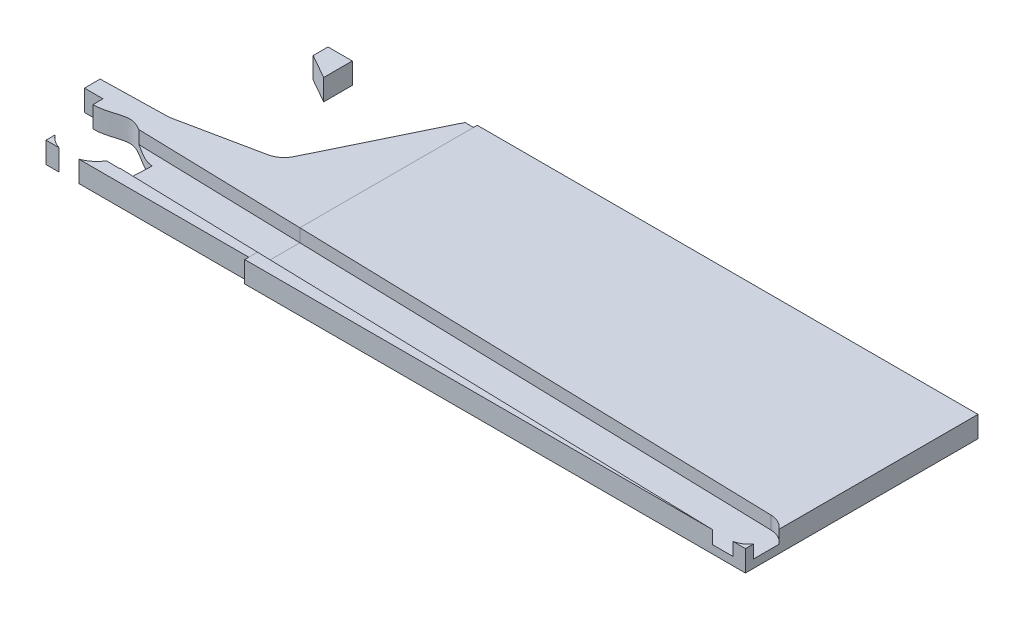
from build123d import *

# Parameters (mm, degrees)
BOSS_EXTRUDE1_DEPTH   = 50.8
BOSS_EXTRUDE1_2_DEPTH = 50.8
SKETCH2_W             = 1201.775932767
SKETCH2_H             = 558.199404441
BOSS_EXTRUDE2_DEPTH   = 50.8
CUT_EXTRUDE1_START    = 50.8
CUT_EXTRUDE1_DEPTH    = 31.242
CUT_EXTRUDE2_DEPTH    = 34.544


with BuildPart() as part:
    # Sketch1 → Boss-Extrude1 (new body)
    with BuildSketch(Plane(origin=(0, 0, 0), x_dir=(1, 0, 0), z_dir=(0, 1, 0))):
        with BuildLine():
            Line((-871.820440323, -76.649300831), (-871.641101875, -114.290321726))
            Line((-871.641101875, -114.290321726), (-827.305117277, -114.290321726))
            Line((-827.305117277, -114.290321726), (-827.305117277, -138.423193725))
            add(Edge.make_bspline(
                [(-827.305117277, -138.423193725), (-792.273117361, -138.423193725), (-743.797362049, -100.228210329), (-689.293747089, -162.520410056), (-659.829397565, -163.748236388)],
                knots=[0, 0, 0, 0, 0.467854577, 1, 1, 1, 1], degree=3))
            Line((-659.829397565, -163.748236388), (-662.985161767, -239.477626694))
            Line((-662.985161767, -239.477626694), (-809.749405531, -236.047842805))
            Line((-809.749405531, -236.047842805), (-809.749405531, -268.614984646))
            Line((-809.749405531, -268.614984646), (-323.022309341, -268.614984646))
            Line((-323.022309341, -268.614984646), (-323.022309341, 270.917349392))
            Line((-323.022309341, 270.917349392), (-343.528617531, 270.917349392))
            Line((-343.528617531, 270.917349392), (-477.930602029, -5.236006151))
            ThreePointArc((-477.930602029, -5.236006151), (-492.433794564, -23.115048161), (-513.339441144, -32.756452519))
            Line((-513.339441144, -32.756452519), (-708.834673801, -73.106313327))
            Line((-708.834673801, -73.106313327), (-871.820440323, -76.649300831))
        make_face()
    extrude(amount=BOSS_EXTRUDE1_DEPTH)


with BuildPart() as body_2:
    # Sketch1 → Boss-Extrude1 2 (new body)
    with BuildSketch(Plane(origin=(0, 0, 0), x_dir=(1, 0, 0), z_dir=(0, 1, 0))):
        Polygon((-606.766159206, 194.877712853), (-606.766159206, 263.51884305), (-665.048893777, 263.51884305), (-665.048893777, 227.910987393), align=None)
    extrude(amount=BOSS_EXTRUDE1_2_DEPTH)


with BuildPart() as body_3:
    # Sketch2 → Boss-Extrude2 (new body)
    with BuildSketch(Plane(origin=(0, 0, 0), x_dir=(1, 0, 0), z_dir=(0, 1, 0))):
        with Locations((277.865657043, 0.779686246)):
            Rectangle(SKETCH2_W, SKETCH2_H)
    extrude(amount=BOSS_EXTRUDE2_DEPTH)


with BuildPart() as cut_extrude1_tool:
    # Sketch4 → Cut-Extrude1 (new body)
    with BuildSketch(Plane(origin=(0, 0, 0), x_dir=(1, 0, 0), z_dir=(0, 1, 0)).offset(CUT_EXTRUDE1_START)):
        with BuildLine():
            Line((839.587388975, -177.854835662), (-780.072920894, -133.572806287))
            ThreePointArc((-780.072920894, -133.572806287), (-810.137959334, -246.945720049), (-693.228451964, -237.485741316))
            Line((-693.228451964, -237.485741316), (836.811695918, -279.34513931))
            ThreePointArc((836.811695918, -279.34513931), (888.945151826, -229.987846529), (839.587388975, -177.854835662))
        make_face()
    extrude(amount=-CUT_EXTRUDE1_DEPTH)


with BuildPart() as part_1:
    add(part.part)

    # Cut-Extrude1: cut by cut_extrude1_tool
    add(cut_extrude1_tool.part, mode=Mode.SUBTRACT)

    # Sketch5 → Cut-Extrude2 (cut)
    with BuildSketch(Plane(origin=(0, 19.558, 0), x_dir=(1, 0, 0), z_dir=(0, 1, 0))):
        with BuildLine():
            Line((-809.749405531, -236.047842805), (-809.749405531, -247.406694678))
            ThreePointArc((-809.749405531, -247.406694678), (-795.746664079, -260.052308022), (-778.933904815, -268.614984646))
            Line((-778.933904815, -268.614984646), (-731.120835745, -268.614984646))
            ThreePointArc((-731.120835745, -268.614984646), (-710.010484249, -256.851914378), (-693.996654331, -238.752908501))
            Line((-693.996654331, -238.752908501), (-809.749405531, -236.047842805))
        make_face()
    extrude(amount=-CUT_EXTRUDE2_DEPTH, mode=Mode.SUBTRACT)


with BuildPart() as body_3_1:
    add(body_3.part)

    # Cut-Extrude1: cut by cut_extrude1_tool
    add(cut_extrude1_tool.part, mode=Mode.SUBTRACT)


with BuildPart() as cut_extrude2_piece_1:
    # of the separate pieces the step leaves, piece 1, a body of its own (cut_extrude2_pieces)
    add(part_1.part.solids().sort_by_distance((-871.820440323, 0, 76.649300831))[0])


with BuildPart() as cut_extrude2_piece_2:
    # of the separate pieces the step leaves, piece 2, a body of its own (cut_extrude2_pieces)
    add(part_1.part.solids().sort_by_distance((-809.749405531, 0, 247.406694678))[0])


solid = Compound([body_2.part, body_3_1.part, cut_extrude2_piece_1.part, cut_extrude2_piece_2.part])
